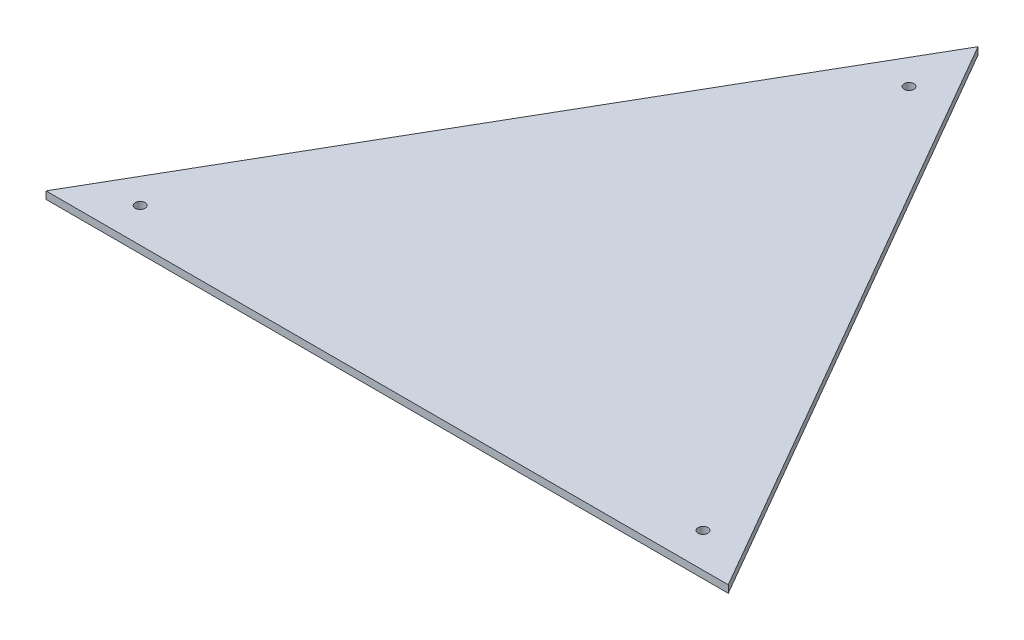
from build123d import *

# Parameters (mm, degrees)
BOSS_EXTRUDE1_DEPTH = 4.7625
SKETCH2_R           = 3.175
CUT_EXTRUDE1_DEPTH  = 337.044165857


with BuildPart() as part:
    # Sketch1 → Boss-Extrude1 (new body)
    with BuildSketch(Plane(origin=(0, 0, 0), x_dir=(1, 0, 0), z_dir=(0, 1, 0))):
        Polygon((0, 254), (-219.970452561, -127), (219.970452561, -127), align=None)
    extrude(amount=BOSS_EXTRUDE1_DEPTH)

    # Sketch2 → Cut-Extrude1 (cut, through all)
    with BuildSketch(Plane(origin=(0, 4.7625, 0), x_dir=(1, 0, 0), z_dir=(0, 1, 0))):
        with Locations(Location((0, 209.55, 0), (0, 0, 270))):
            Circle(SKETCH2_R)
        with Locations(Location((-181.475623363, -104.775, 0), (0, 0, 270))):
            Circle(SKETCH2_R)
        with Locations(Location((181.475623363, -104.775, 0), (0, 0, 270))):
            Circle(SKETCH2_R)
    extrude(amount=-CUT_EXTRUDE1_DEPTH, mode=Mode.SUBTRACT)


solid = part.part
